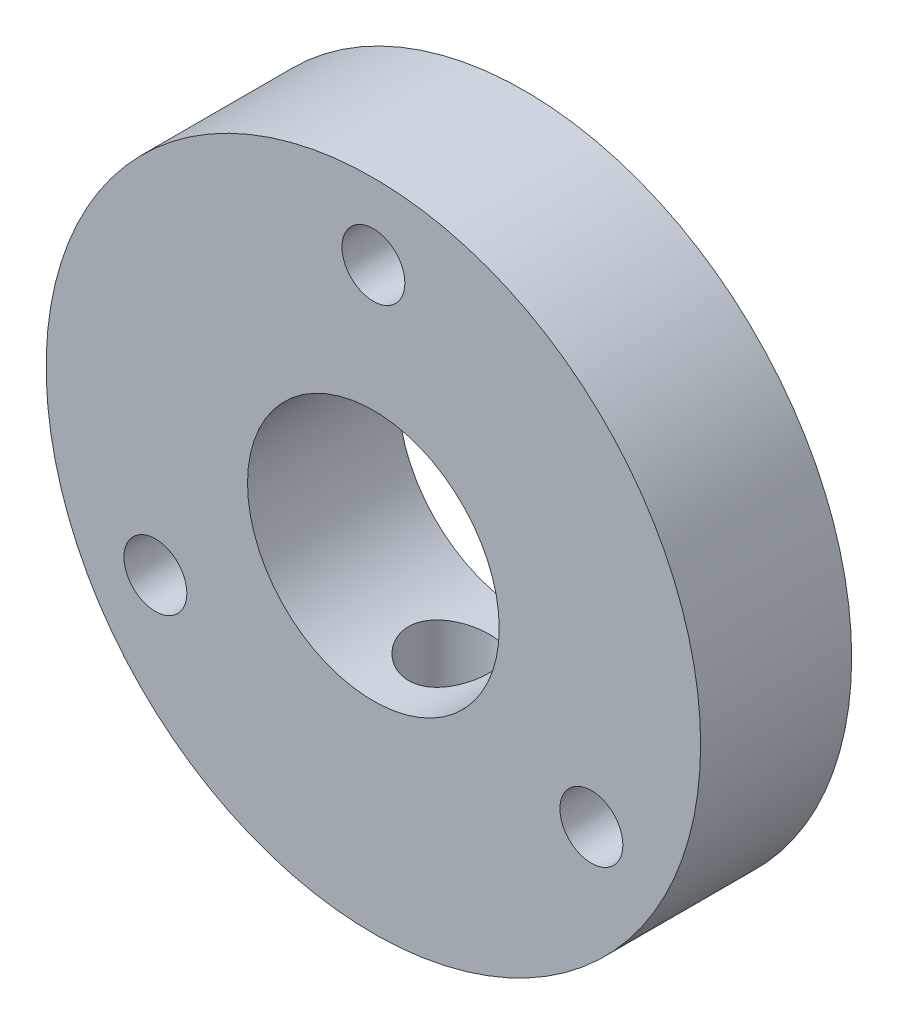
from build123d import *

# Parameters (mm, degrees)
MODEL_R             = 6.5
EXTRUDE_338_DEPTH   = 1.5
SKETCH_3_R          = 2.5
CUT_EXTRUDE_1_DEPTH = 10.669539803
HOLE_WIZARD_M1_6_D  = 1.25
SKETCH_8_W          = 0.8
SKETCH_8_H          = 6.5


with BuildPart() as part:
    # Model → Extrude 338 (new, symmetric)
    with BuildSketch(Plane.XY):
        Circle(MODEL_R)
    extrude(amount=EXTRUDE_338_DEPTH, both=True)

    # Эскиз3 → Вырез-Вытянуть1 (cut, through all)
    with BuildSketch(Plane.XY.offset(1.5)):
        Circle(SKETCH_3_R)
    extrude(amount=-CUT_EXTRUDE_1_DEPTH, mode=Mode.SUBTRACT)

    # Крепление шестерни M1.6 (through all)
    with Locations(Plane.XY.offset(1.5)):
        with Locations((0, 5), (4.330127019, -2.5), (-4.330127019, -2.5)):
            Hole(HOLE_WIZARD_M1_6_D / 2)

    # Эскиз8 → Крепление на вал M2 (revolve, cut)
    with BuildSketch(Plane(origin=(0, 0, 0), x_dir=(0, 0, 1), z_dir=(1, 0, 0))):
        with Locations((0.4, 3.25)):
            Rectangle(SKETCH_8_W, SKETCH_8_H)
    revolve(axis=Axis((0, 6.35, 0), (0, -1, 0)), mode=Mode.SUBTRACT)


solid = part.part
